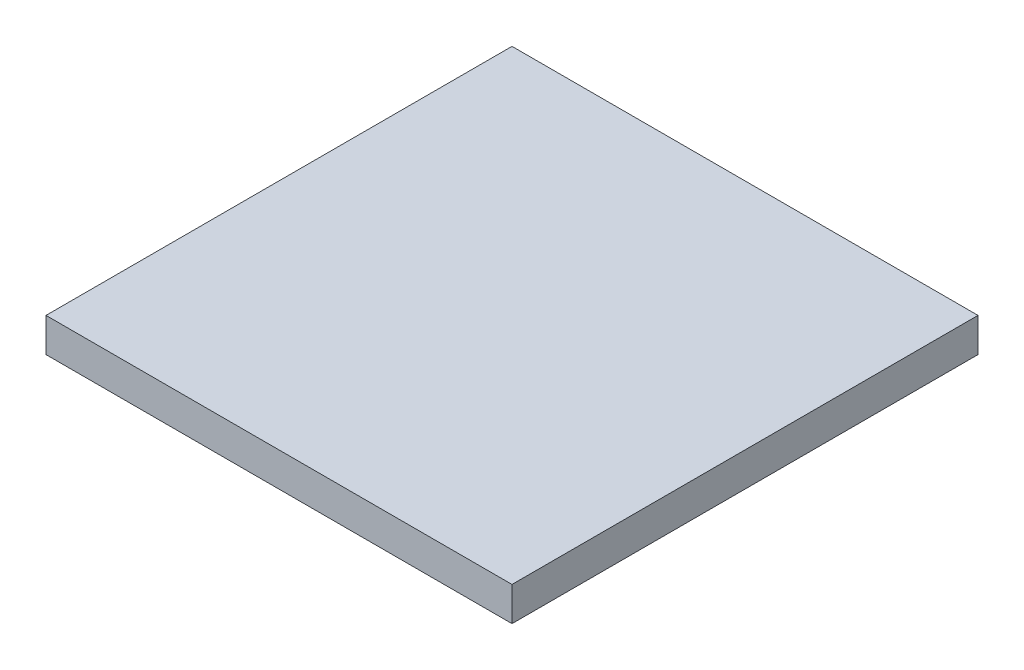
from build123d import *

# Parameters (mm, degrees)
SKETCH1_W           = 342.9
SKETCH1_H           = 342.9
BOSS_EXTRUDE1_DEPTH = 25


with BuildPart() as part:
    # Sketch1 → Boss-Extrude1 (new body)
    with BuildSketch(Plane(origin=(0, 0, 0), x_dir=(1, 0, 0), z_dir=(0, 1, 0))):
        Rectangle(SKETCH1_W, SKETCH1_H)
    extrude(amount=-BOSS_EXTRUDE1_DEPTH)


solid = part.part
